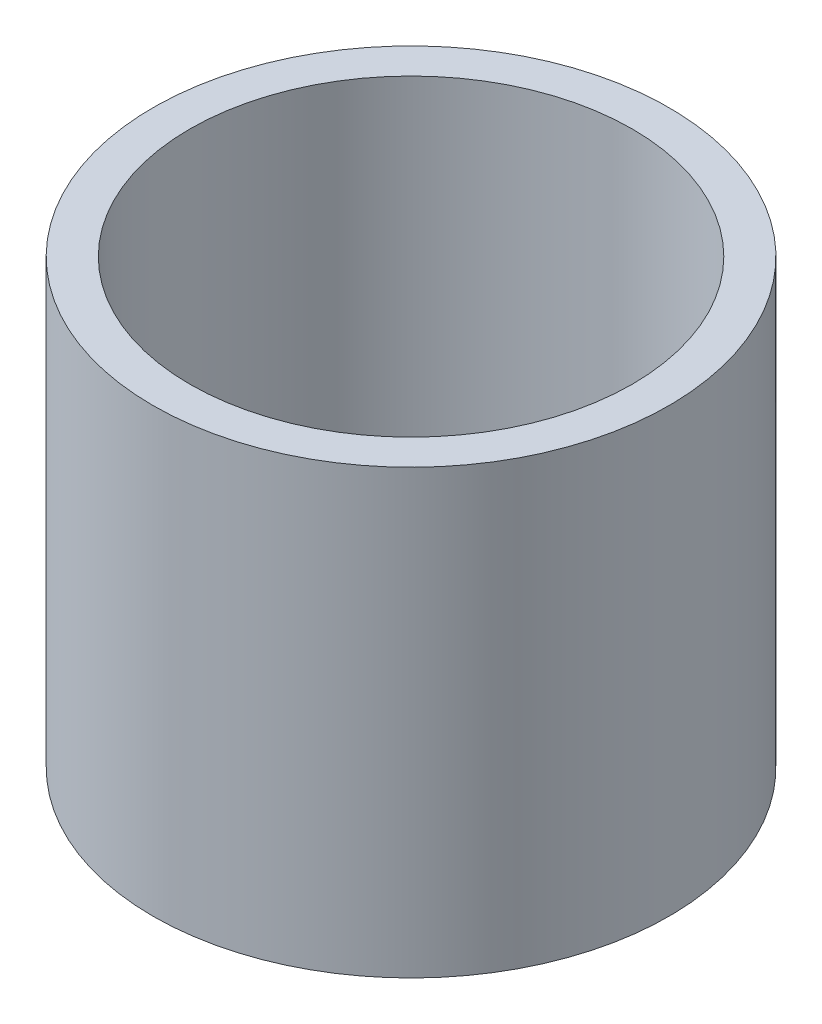
from build123d import *

# Parameters (mm, degrees)
SKETCH1_R           = 35
SKETCH1_R_2         = 30
BOSS_EXTRUDE1_DEPTH = 60


with BuildPart() as part:
    # Sketch1 → Boss-Extrude1 (new body)
    with BuildSketch(Plane(origin=(0, 0, 0), x_dir=(1, 0, 0), z_dir=(0, 1, 0))):
        with Locations(Location((0, 0, 0), (0, 0, 270))):
            Circle(SKETCH1_R)
        with Locations(Location((0, 0, 0), (0, 0, 270))):
            Circle(SKETCH1_R_2, mode=Mode.SUBTRACT)
    extrude(amount=BOSS_EXTRUDE1_DEPTH)


solid = part.part
